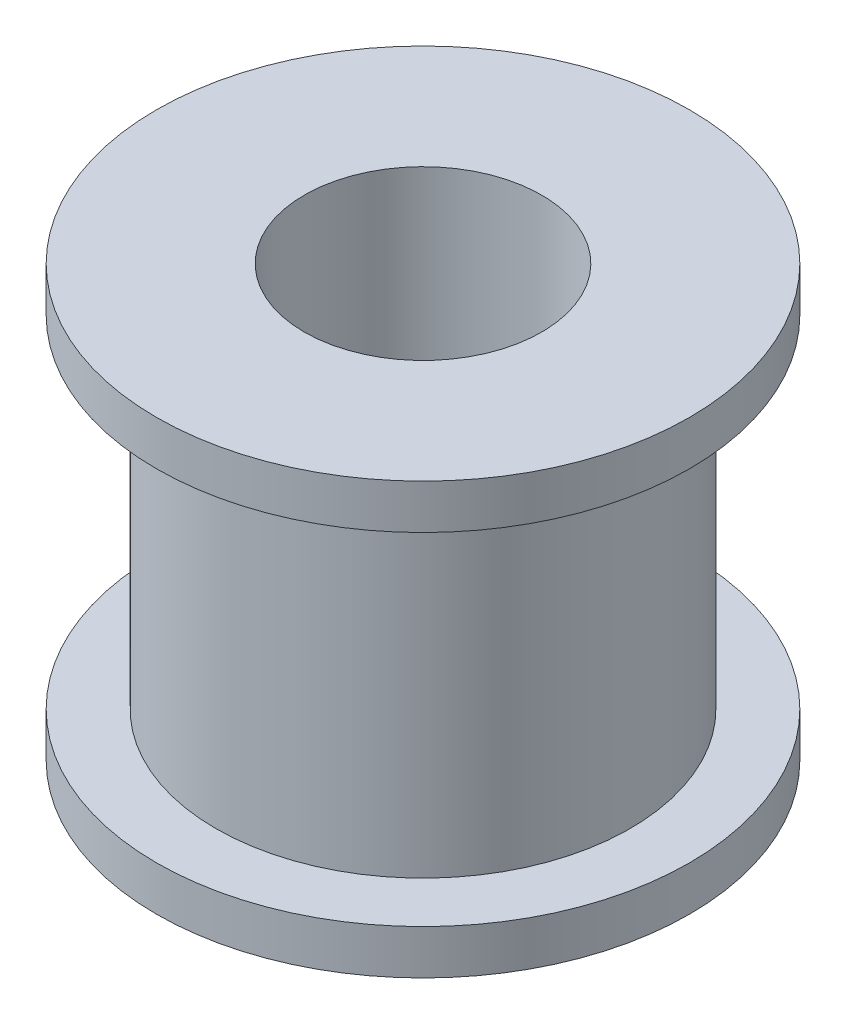
from build123d import *


with BuildPart() as part:
    # Sketch1 → Revolve1 (revolve)
    with BuildSketch(Plane(origin=(0, 0, 0), x_dir=(0, 0, -1), z_dir=(1, 0, 0)), mode=Mode.PRIVATE) as revolve1_sk:
        Polygon((6.98, -5.75), (6.98, 5.75), (8.98, 5.75), (8.98, 7.25), (4, 7.25), (4, -7.25), (8.98, -7.25), (8.98, -5.75), align=None)
    revolve(revolve1_sk.sketch.rotate(Axis((0, 10.31552251, 0), (0, -1, 0)), 180), axis=Axis((0, 10.31552251, 0), (0, -1, 0)))


solid = part.part
